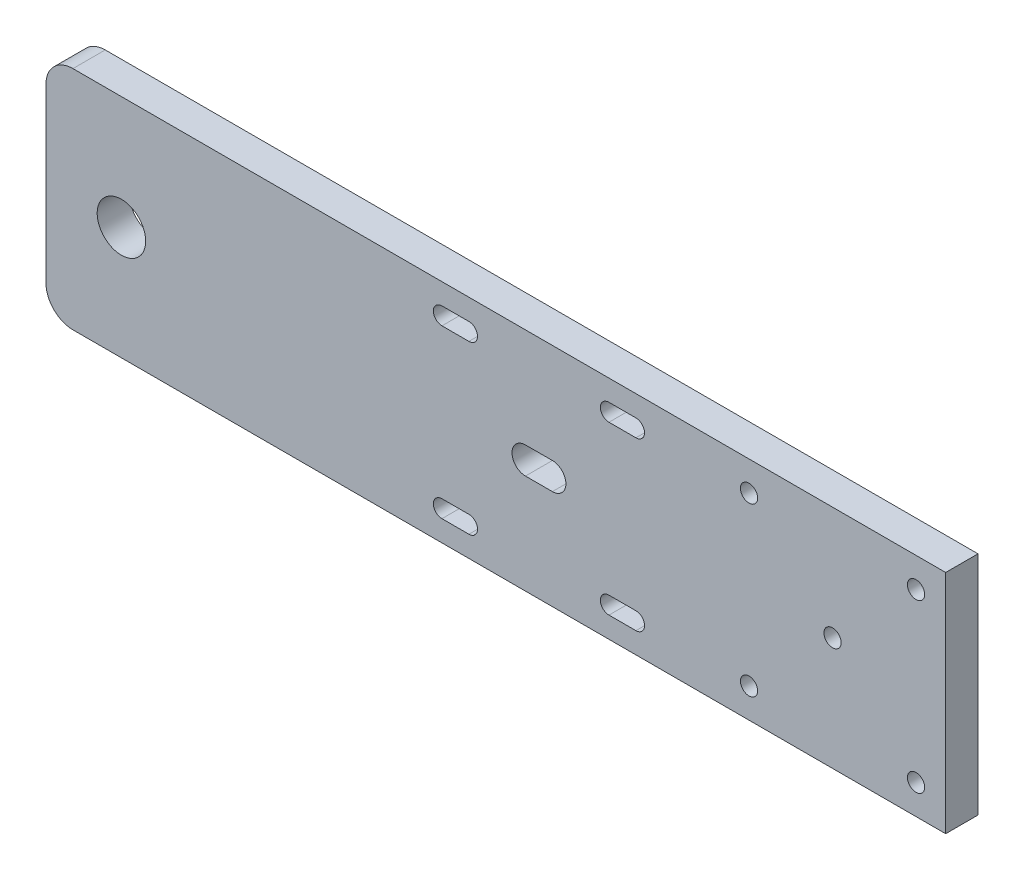
from build123d import *

# Parameters (mm, degrees)
SKETCH_1_W      = 63
SKETCH_1_H      = 42
SKETCH_1_R      = 4.5
SKETCH_1_W_2    = 10
SKETCH_1_W_3    = 42
SKETCH_1_R_2    = 1.6
SKETCH_1_W_4    = 5
EXTRUDE_1_DEPTH = 6
FILLET_1_R      = 5


with BuildPart() as part:
    # 草图1 → 凸台-拉伸1 (new body)
    # profile 1 of 7: a face of its own
    with BuildSketch(Plane.XY):
        with Locations((-109.5, 0)):
            Rectangle(SKETCH_1_W, SKETCH_1_H)
        with Locations((-132, 0)):
            Circle(SKETCH_1_R, mode=Mode.SUBTRACT)
    # profile 2 of 7: a face of its own
    with BuildSketch(Plane.XY):
        with BuildLine():
            Line((-73, 21), (-78, 21))
            Line((-78, 21), (-78, -21))
            Line((-78, -21), (-73, -21))
            Line((-73, -21), (-73, -17.019868415))
            ThreePointArc((-73, -17.019868415), (-74.1, -15.5), (-73, -13.980131585))
            Line((-73, -13.980131585), (-73, 13.980131585))
            ThreePointArc((-73, 13.980131585), (-74.1, 15.5), (-73, 17.019868415))
            Line((-73, 17.019868415), (-73, 21))
        make_face()
    # profile 3 of 7: a face of its own
    with BuildSketch(Plane.XY):
        with BuildLine():
            Line((-36, 21), (-73, 21))
            Line((-73, 21), (-73, 17.019868415))
            ThreePointArc((-73, 17.019868415), (-72.753190181, 17.079840097), (-72.5, 17.1))
            Line((-72.5, 17.1), (-67.5, 17.1))
            ThreePointArc((-67.5, 17.1), (-65.9, 15.5), (-67.5, 13.9))
            Line((-67.5, 13.9), (-72.5, 13.9))
            ThreePointArc((-72.5, 13.9), (-72.753190181, 13.920159903), (-73, 13.980131585))
            Line((-73, 13.980131585), (-73, -13.980131585))
            ThreePointArc((-73, -13.980131585), (-72.753190181, -13.920159903), (-72.5, -13.9))
            Line((-72.5, -13.9), (-67.5, -13.9))
            ThreePointArc((-67.5, -13.9), (-65.9, -15.5), (-67.5, -17.1))
            Line((-67.5, -17.1), (-72.5, -17.1))
            ThreePointArc((-72.5, -17.1), (-72.753190181, -17.079840097), (-73, -17.019868415))
            Line((-73, -17.019868415), (-73, -21))
            Line((-73, -21), (-36, -21))
            Line((-36, -21), (-36, -17.019868415))
            ThreePointArc((-36, -17.019868415), (-36.246809819, -17.079840097), (-36.5, -17.1))
            Line((-36.5, -17.1), (-41.5, -17.1))
            ThreePointArc((-41.5, -17.1), (-43.1, -15.5), (-41.5, -13.9))
            Line((-41.5, -13.9), (-36.5, -13.9))
            ThreePointArc((-36.5, -13.9), (-36.246809819, -13.920159903), (-36, -13.980131585))
            Line((-36, -13.980131585), (-36, 13.980131585))
            ThreePointArc((-36, 13.980131585), (-36.246809819, 13.920159903), (-36.5, 13.9))
            Line((-36.5, 13.9), (-41.5, 13.9))
            ThreePointArc((-41.5, 13.9), (-43.1, 15.5), (-41.5, 17.1))
            Line((-41.5, 17.1), (-36.5, 17.1))
            ThreePointArc((-36.5, 17.1), (-36.246809819, 17.079840097), (-36, 17.019868415))
            Line((-36, 17.019868415), (-36, 21))
        make_face()
        with BuildLine():
            ThreePointArc((-57, -2.5), (-59.5, 0), (-57, 2.5))
            Line((-57, 2.5), (-52, 2.5))
            ThreePointArc((-52, 2.5), (-49.5, 0), (-52, -2.5))
            Line((-52, -2.5), (-57, -2.5))
        make_face(mode=Mode.SUBTRACT)
    # profile 4 of 7: a face of its own
    with BuildSketch(Plane.XY):
        with BuildLine():
            Line((-31, 21), (-36, 21))
            Line((-36, 21), (-36, 17.019868415))
            ThreePointArc((-36, 17.019868415), (-34.9, 15.5), (-36, 13.980131585))
            Line((-36, 13.980131585), (-36, -13.980131585))
            ThreePointArc((-36, -13.980131585), (-34.9, -15.5), (-36, -17.019868415))
            Line((-36, -17.019868415), (-36, -21))
            Line((-36, -21), (-31, -21))
            Line((-31, -21), (-31, 21))
        make_face()
    # profile 5 of 7: a face of its own
    with BuildSketch(Plane.XY):
        with Locations((-26, 0)):
            Rectangle(SKETCH_1_W_2, SKETCH_1_H)
    # profile 6 of 7: a face of its own
    with BuildSketch(Plane.XY):
        Rectangle(SKETCH_1_W_3, SKETCH_1_H)
        with Locations((15.5, -15.5)):
            Circle(SKETCH_1_R_2, mode=Mode.SUBTRACT)
        with Locations((-15.5, -15.5)):
            Circle(SKETCH_1_R_2, mode=Mode.SUBTRACT)
        with Locations((15.5, 15.5)):
            Circle(SKETCH_1_R_2, mode=Mode.SUBTRACT)
        with Locations((-15.5, 15.5)):
            Circle(SKETCH_1_R_2, mode=Mode.SUBTRACT)
        Circle(SKETCH_1_R_2, mode=Mode.SUBTRACT)
    # profile 7 of 7: a face of its own
    with BuildSketch(Plane.XY):
        with Locations((-143.5, 0)):
            Rectangle(SKETCH_1_W_4, SKETCH_1_H)
    extrude(amount=EXTRUDE_1_DEPTH)

    # 圆角1
    fillet_1_edges = [part.edges().sort_by_distance(p)[0] for p in [
        (-146, 21, 3),
        (-146, -21, 3),
    ]]
    fillet(fillet_1_edges, radius=FILLET_1_R)


solid = part.part
